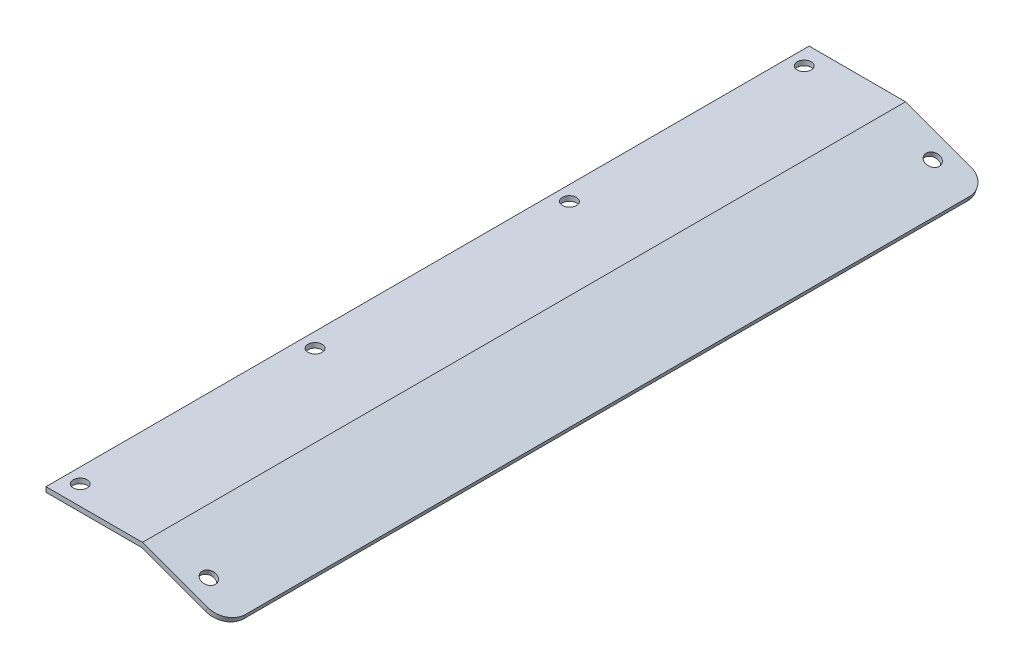
from build123d import *

# Parameters (mm, degrees)
BOSS_EXTRUDE1_DEPTH = 247.65
SKETCH2_R           = 2.286
CUT_EXTRUDE1_DEPTH  = 255.69929163
SKETCH3_R           = 2.286
CUT_EXTRUDE2_DEPTH  = 255.408366321
FILLET1_R           = 6.35


with BuildPart() as part:
    # Sketch1 → Boss-Extrude1 (new body)
    with BuildSketch(Plane.XY):
        Polygon((0, 0), (31.018857102, 0), (57.870573741, -9.773225596), (58.413530719, -8.28146356), (31.298776184, 1.5875), (0, 1.5875), align=None)
    extrude(amount=BOSS_EXTRUDE1_DEPTH)

    # Sketch2 → Cut-Extrude1 (cut, through all)
    with BuildSketch(Plane(origin=(0, 1.5875, 0), x_dir=(1, 0, 0), z_dir=(0, 1, 0))):
        with Locations(Location((4.7625, -6.35, 0), (0, 0, 180))):
            Circle(SKETCH2_R)
        with Locations(Location((4.7625, -241.3, 0), (0, 0, 180))):
            Circle(SKETCH2_R)
        with Locations(Location((4.7625, -82.55, 0), (0, 0, 180))):
            Circle(SKETCH2_R)
        with Locations(Location((4.7625, -165.1, 0), (0, 0, 180))):
            Circle(SKETCH2_R)
    extrude(amount=-CUT_EXTRUDE1_DEPTH, mode=Mode.SUBTRACT)

    # Sketch3 → Cut-Extrude2 (cut, through all)
    with BuildSketch(Plane(origin=(4.171473971, 11.461030541, 0), x_dir=(0.9396926207859064, -0.34202014332567426, 0), z_dir=(0.34202014332567426, 0.9396926207859064, 0))):
        with Locations(Location((45.023191124, -6.35, 0), (0, 0, 180))):
            Circle(SKETCH3_R)
        with Locations(Location((45.023191124, -241.3, 0), (0, 0, 180))):
            Circle(SKETCH3_R)
    extrude(amount=-CUT_EXTRUDE2_DEPTH, mode=Mode.SUBTRACT)

    # Fillet1
    fillet1_edges = [part.edges().sort_by_distance(p)[0] for p in [
        (58.14205223, -9.027344578, 0),
        (58.14205223, -9.027344578, 247.65),
    ]]
    fillet(fillet1_edges, radius=FILLET1_R)


solid = part.part
